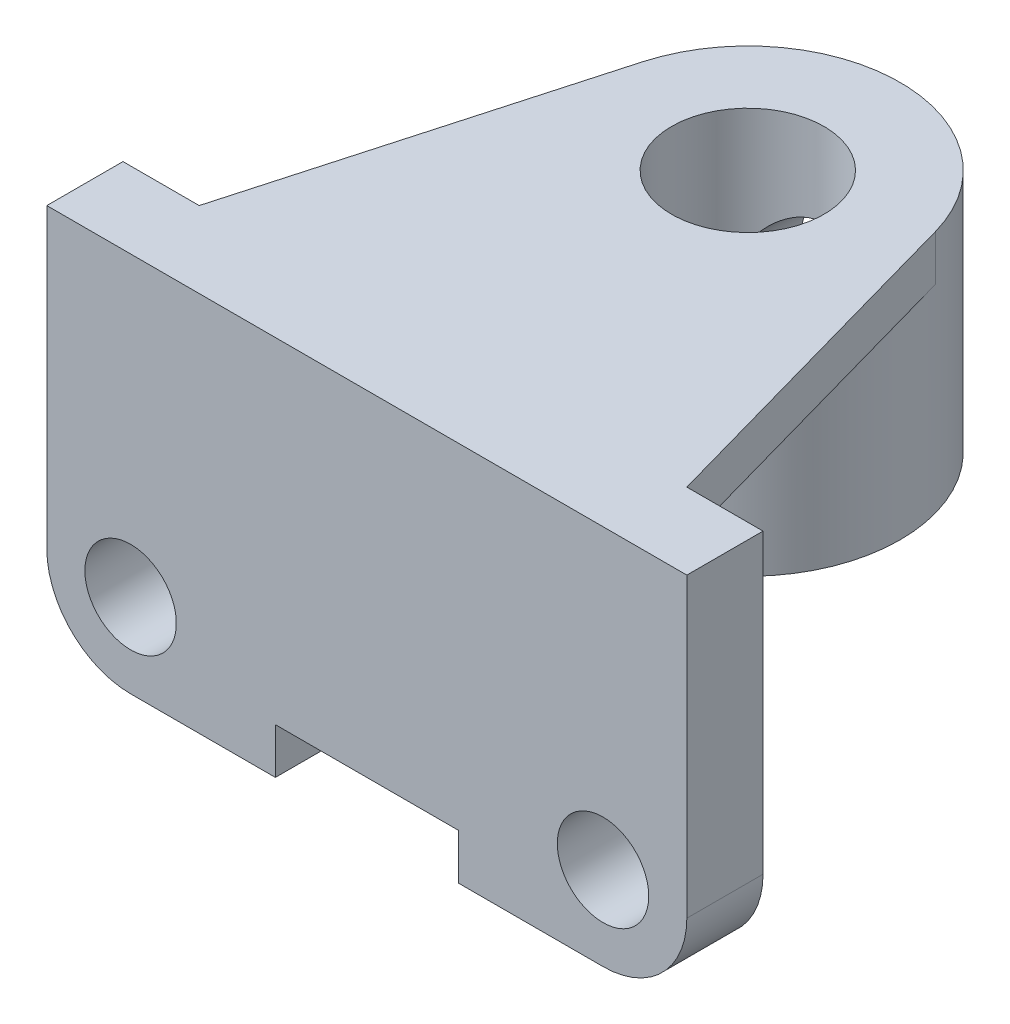
from build123d import *

# Parameters (mm, degrees)
SKETCH_1_R          = 6
EXTRUDE_1_DEPTH     = 10
SKETCH_2_R          = 10
EXTRUDE_2_DEPTH     = 6
SKETCH_2_3_R        = 10
EXTRUDE_3_DEPTH     = 32
CUT_EXTRUDE_1_REACH = 94.136
SKETCH_3_R          = 8


with BuildPart() as part:
    # 草图1 → 凸台-拉伸1 (new body)
    with BuildSketch(Plane.XY):
        with BuildLine():
            Line((-31, -50), (-12, -50))
            Line((-12, -50), (-12, -44))
            Line((-12, -44), (12, -44))
            Line((12, -44), (12, -50))
            Line((12, -50), (31, -50))
            ThreePointArc((31, -50), (38.778174593, -46.778174593), (42, -39))
            Line((42, -39), (42, 0))
            Line((42, 0), (-42, 0))
            Line((-42, 0), (-42, -39))
            ThreePointArc((-42, -39), (-38.778174593, -46.778174593), (-31, -50))
        make_face()
        with Locations((31, -39)):
            Circle(SKETCH_1_R, mode=Mode.SUBTRACT)
        with Locations((-31, -39)):
            Circle(SKETCH_1_R, mode=Mode.SUBTRACT)
    extrude(amount=EXTRUDE_1_DEPTH)

    # 草图2 → 凸台-拉伸2 (add)
    with BuildSketch(Plane(origin=(0, 0, 0), x_dir=(1, 0, 0), z_dir=(0, 1, 0))):
        with BuildLine():
            Line((32, 0), (19.255885515, 45.404708412))
            ThreePointArc((19.255885515, 45.404708412), (0, 60), (-19.255885515, 45.404708412))
            Line((-19.255885515, 45.404708412), (-32, 0))
            Line((-32, 0), (32, 0))
        make_face()
        with Locations((0, 40)):
            Circle(SKETCH_2_R, mode=Mode.SUBTRACT)
    extrude(amount=-EXTRUDE_2_DEPTH)

    # 草图2<3> → 凸台-拉伸3 (add)
    with BuildSketch(Plane(origin=(0, 0, 0), x_dir=(1, 0, 0), z_dir=(0, 1, 0))):
        with BuildLine():
            ThreePointArc((3, 20.226280067), (16.802363629, 29.151932131), (19.255885515, 45.404708412))
            ThreePointArc((19.255885515, 45.404708412), (16.936067955, 50.638120239), (13.228756555, 55))
            Line((13.228756555, 55), (-13.228756555, 55))
            ThreePointArc((-13.228756555, 55), (-16.936067955, 50.638120239), (-19.255885515, 45.404708412))
            ThreePointArc((-19.255885515, 45.404708412), (-16.802363629, 29.151932131), (-3, 20.226280067))
            Line((-3, 20.226280067), (-3, 0))
            Line((-3, 0), (3, 0))
            Line((3, 0), (3, 20.226280067))
        make_face()
        with Locations((0, 40)):
            Circle(SKETCH_2_3_R, mode=Mode.SUBTRACT)
    extrude(amount=-EXTRUDE_3_DEPTH)

    # 草图3 → 切除-拉伸1 (cut, up to next)
    with BuildSketch(Plane(origin=(0, 0, -55), x_dir=(-1, 0, 0), z_dir=(0, 0, -1)), mode=Mode.PRIVATE) as cut_extrude_1_sk1:
        with Locations((0, -19)):
            Circle(SKETCH_3_R)
    cut_extrude_1_tool1 = extrude(cut_extrude_1_sk1.sketch, amount=-CUT_EXTRUDE_1_REACH, mode=Mode.PRIVATE) & part.part
    add(cut_extrude_1_tool1.solids().sort_by_distance((0, -19, -55))[0], mode=Mode.SUBTRACT)


solid = part.part
